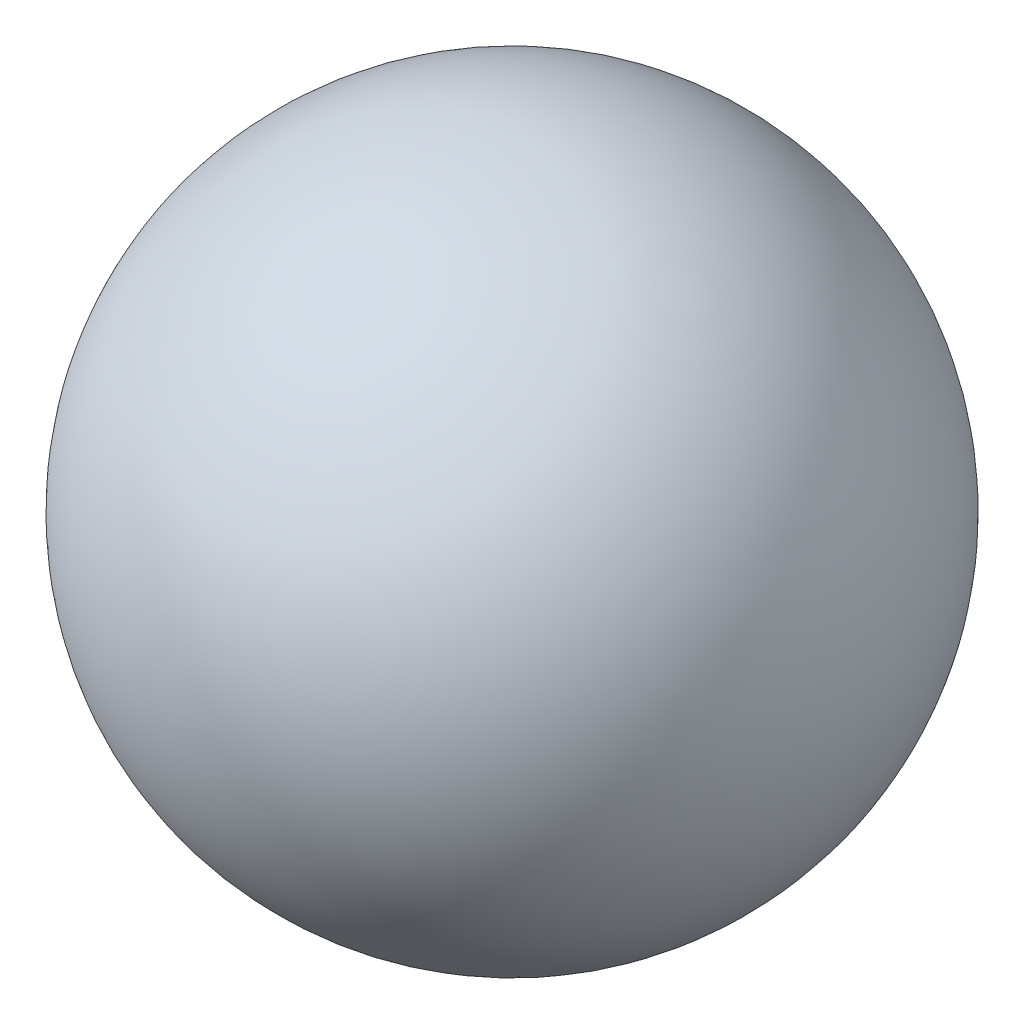
from build123d import *


with BuildPart() as part:
    # Sketch1 → Revolve1 (revolve)
    with BuildSketch(Plane.XY):
        with BuildLine():
            Line((-2.5908, 0.1778), (2.5908, 0.1778))
            ThreePointArc((2.5908, 0.1778), (0, 2.7686), (-2.5908, 0.1778))
        make_face()
    revolve(axis=Axis((-2.5908, 0.1778, 0), (1, 0, 0)))


solid = part.part
